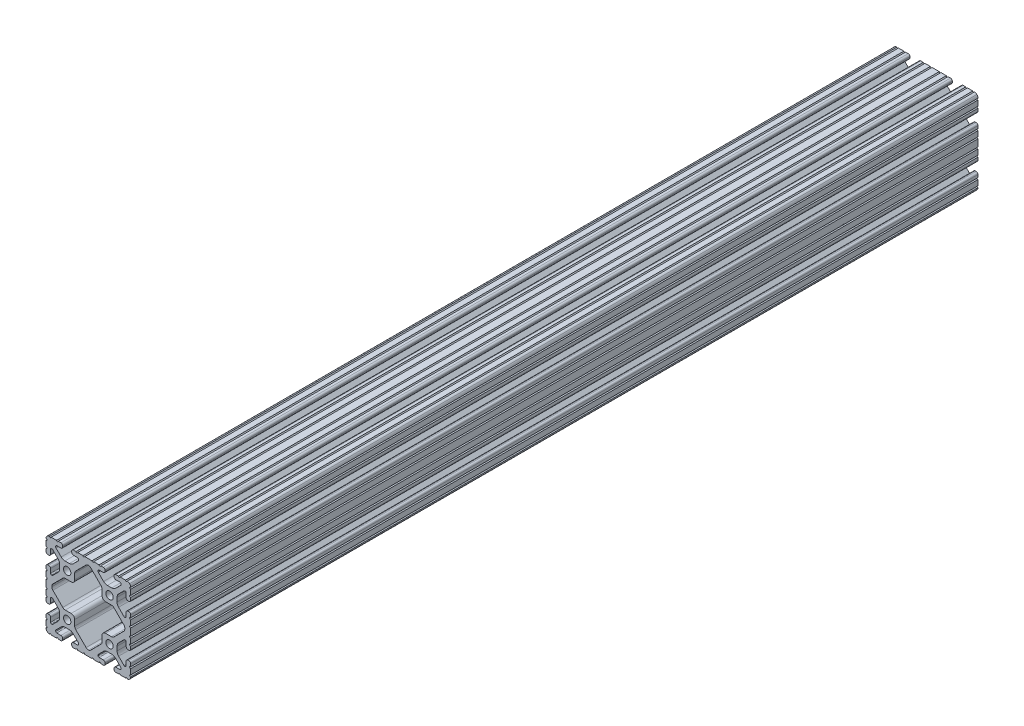
from build123d import *

# Parameters (mm, degrees)
BOSS_EXTRUDE1_DEPTH      = 381
BOSS_EXTRUDE1_DEPTH_BACK = 381
SKETCH3_R                = 3.3274


with BuildPart() as part:
    # Sketch3 → Boss-Extrude1 (new, two sides: drawn at the far end of the back side and taken through both)
    with BuildSketch(Plane.XY.offset(-BOSS_EXTRUDE1_DEPTH_BACK)):
        with BuildLine():
            Line((34.036, 28.448), (34.036, 24.630196049))
            ThreePointArc((34.036, 24.630196049), (34.497248241, 23.51664429), (35.6108, 23.055396049))
            Line((35.6108, 23.055396049), (36.525200183, 23.055396049))
            ThreePointArc((36.525200183, 23.055396049), (37.638751813, 23.516644236), (38.1, 24.630195866))
            Line((38.1, 24.630195866), (38.1, 27.023826138))
            ThreePointArc((38.1, 27.023826138), (37.117780706, 27.7845421), (38.1, 28.545258062))
            Line((38.1, 28.545258062), (38.1, 33.373016026))
            ThreePointArc((38.1, 33.373016026), (37.141472621, 34.109236774), (38.1, 34.845457521))
            ThreePointArc((38.1, 34.845457521), (37.837757813, 36.120195002), (37.086123144, 37.182631793))
            ThreePointArc((37.086123144, 37.182631793), (36.106286572, 37.843374398), (34.952681874, 38.1))
            ThreePointArc((34.952681874, 38.1), (34.190730434, 37.320215335), (33.428778994, 38.1))
            Line((33.428778994, 38.1), (28.601105935, 38.1))
            ThreePointArc((28.601105935, 38.1), (27.839158581, 37.32021942), (27.077211227, 38.1))
            Line((27.077211227, 38.1), (24.6888, 38.1))
            ThreePointArc((24.6888, 38.1), (23.575248241, 37.638751759), (23.114, 36.5252))
            Line((23.114, 36.5252), (23.114, 35.6108))
            ThreePointArc((23.114, 35.6108), (23.575248241, 34.497248241), (24.6888, 34.036))
            Line((24.6888, 34.036), (28.448, 34.036))
            ThreePointArc((28.448, 34.036), (29.076617928, 33.775617928), (29.337, 33.147))
            Line((29.337, 33.147), (29.337, 32.720693454))
            ThreePointArc((29.337, 32.720693454), (29.326675076, 32.273872751), (29.100231244, 31.888543625))
            Line((29.100231244, 31.888543625), (24.409287499, 27.197588341))
            ThreePointArc((24.409287499, 27.197588341), (22.868340045, 26.167958114), (21.050667579, 25.8064))
            Line((21.050667579, 25.8064), (17.049332421, 25.8064))
            ThreePointArc((17.049332421, 25.8064), (15.231659955, 26.167958114), (13.690712501, 27.197588341))
            Line((13.690712501, 27.197588341), (9.023381298, 31.864931024))
            ThreePointArc((9.023381298, 31.864931024), (8.830670886, 32.153343113), (8.763, 32.493548179))
            Line((8.763, 32.493548179), (8.763, 33.147))
            ThreePointArc((8.763, 33.147), (9.023382072, 33.775617928), (9.652, 34.036))
            Line((9.652, 34.036), (13.4112, 34.036))
            ThreePointArc((13.4112, 34.036), (14.524751759, 34.497248241), (14.986, 35.6108))
            Line((14.986, 35.6108), (14.986, 36.5252))
            ThreePointArc((14.986, 36.5252), (14.524751759, 37.638751759), (13.4112, 38.1))
            Line((13.4112, 38.1), (11.128867074, 38.1))
            ThreePointArc((11.128867074, 38.1), (10.367071033, 37.320370693), (9.605274992, 38.1))
            Line((9.605274992, 38.1), (4.777313069, 38.1))
            ThreePointArc((4.777313069, 38.1), (4.015517029, 37.320370693), (3.253720988, 38.1))
            Line((3.253720988, 38.1), (-3.253720988, 38.1))
            ThreePointArc((-3.253720988, 38.1), (-4.015517029, 37.320370693), (-4.777313069, 38.1))
            Line((-4.777313069, 38.1), (-9.605274992, 38.1))
            ThreePointArc((-9.605274992, 38.1), (-10.367071033, 37.320370693), (-11.128867074, 38.1))
            Line((-11.128867074, 38.1), (-13.4112, 38.1))
            ThreePointArc((-13.4112, 38.1), (-14.524751759, 37.638751759), (-14.986, 36.5252))
            Line((-14.986, 36.5252), (-14.986, 35.6108))
            ThreePointArc((-14.986, 35.6108), (-14.524751759, 34.497248241), (-13.4112, 34.036))
            Line((-13.4112, 34.036), (-9.652, 34.036))
            ThreePointArc((-9.652, 34.036), (-9.023382072, 33.775617928), (-8.763, 33.147))
            Line((-8.763, 33.147), (-8.763, 32.493548179))
            ThreePointArc((-8.763, 32.493548179), (-8.830670886, 32.153343113), (-9.023381298, 31.864931024))
            Line((-9.023381298, 31.864931024), (-13.690712501, 27.197588341))
            ThreePointArc((-13.690712501, 27.197588341), (-15.231659955, 26.167958114), (-17.049332421, 25.8064))
            Line((-17.049332421, 25.8064), (-21.050667579, 25.8064))
            ThreePointArc((-21.050667579, 25.8064), (-22.868340045, 26.167958114), (-24.409287499, 27.197588341))
            Line((-24.409287499, 27.197588341), (-29.100231244, 31.888543625))
            ThreePointArc((-29.100231244, 31.888543625), (-29.326675076, 32.273872751), (-29.337, 32.720693454))
            Line((-29.337, 32.720693454), (-29.337, 33.147))
            ThreePointArc((-29.337, 33.147), (-29.076617928, 33.775617928), (-28.448, 34.036))
            Line((-28.448, 34.036), (-24.6888, 34.036))
            ThreePointArc((-24.6888, 34.036), (-23.575248241, 34.497248241), (-23.114, 35.6108))
            Line((-23.114, 35.6108), (-23.114, 36.5252))
            ThreePointArc((-23.114, 36.5252), (-23.575248241, 37.638751759), (-24.6888, 38.1))
            Line((-24.6888, 38.1), (-27.077211227, 38.1))
            ThreePointArc((-27.077211227, 38.1), (-27.839158581, 37.32021942), (-28.601105935, 38.1))
            Line((-28.601105935, 38.1), (-33.428778994, 38.1))
            ThreePointArc((-33.428778994, 38.1), (-34.190730434, 37.320215335), (-34.952681874, 38.1))
            ThreePointArc((-34.952681874, 38.1), (-36.106286572, 37.843374398), (-37.086123144, 37.182631793))
            ThreePointArc((-37.086123144, 37.182631793), (-37.837757813, 36.120195002), (-38.1, 34.845457521))
            ThreePointArc((-38.1, 34.845457521), (-37.141472621, 34.109236774), (-38.1, 33.373016026))
            Line((-38.1, 33.373016026), (-38.1, 28.545258062))
            ThreePointArc((-38.1, 28.545258062), (-37.117780706, 27.7845421), (-38.1, 27.023826138))
            Line((-38.1, 27.023826138), (-38.1, 24.630195866))
            ThreePointArc((-38.1, 24.630195866), (-37.638751813, 23.516644236), (-36.525200183, 23.055396049))
            Line((-36.525200183, 23.055396049), (-35.6108, 23.055396049))
            ThreePointArc((-35.6108, 23.055396049), (-34.497248241, 23.51664429), (-34.036, 24.630196049))
            Line((-34.036, 24.630196049), (-34.036, 28.448))
            ThreePointArc((-34.036, 28.448), (-33.775617928, 29.076617928), (-33.147, 29.337))
            Line((-33.147, 29.337), (-32.664287242, 29.337))
            ThreePointArc((-32.664287242, 29.337), (-32.324081166, 29.269328695), (-32.03566854, 29.076617155))
            Line((-32.03566854, 29.076617155), (-27.19758008, 24.238516795))
            ThreePointArc((-27.19758008, 24.238516795), (-26.167955879, 22.697572205), (-25.8064, 20.879905136))
            Line((-25.8064, 20.879905136), (-25.8064, 17.220094864))
            ThreePointArc((-25.8064, 17.220094864), (-26.167955879, 15.402427795), (-27.19758008, 13.861483205))
            Line((-27.19758008, 13.861483205), (-31.948944541, 9.110107057))
            ThreePointArc((-31.948944541, 9.110107057), (-32.333417096, 8.853210196), (-32.786933649, 8.763))
            Line((-32.786933649, 8.763), (-33.060275787, 8.763))
            ThreePointArc((-33.060275787, 8.763), (-33.750216995, 9.048783005), (-34.036, 9.738724213))
            Line((-34.036, 9.738724213), (-34.036, 13.469803585))
            ThreePointArc((-34.036, 13.469803585), (-34.497248348, 14.583355603), (-35.610800366, 15.044603951))
            Line((-35.610800366, 15.044603951), (-36.5252, 15.044603951))
            ThreePointArc((-36.5252, 15.044603951), (-37.638751759, 14.58335571), (-38.1, 13.469803951))
            Line((-38.1, 13.469803951), (-38.1, 11.075039289))
            ThreePointArc((-38.1, 11.075039289), (-37.117000248, 10.313517272), (-38.1, 9.551995255))
            Line((-38.1, 9.551995255), (-38.1, 4.723759308))
            ThreePointArc((-38.1, 4.723759308), (-37.117000248, 3.962237292), (-38.1, 3.200715275))
            Line((-38.1, 3.200715275), (-38.1, -3.200715275))
            ThreePointArc((-38.1, -3.200715275), (-37.117000248, -3.962237292), (-38.1, -4.723759308))
            Line((-38.1, -4.723759308), (-38.1, -9.551995255))
            ThreePointArc((-38.1, -9.551995255), (-37.117000248, -10.313517272), (-38.1, -11.075039289))
            Line((-38.1, -11.075039289), (-38.1, -13.469803951))
            ThreePointArc((-38.1, -13.469803951), (-37.638751759, -14.58335571), (-36.5252, -15.044603951))
            Line((-36.5252, -15.044603951), (-35.610800366, -15.044603951))
            ThreePointArc((-35.610800366, -15.044603951), (-34.497248348, -14.583355603), (-34.036, -13.469803585))
            Line((-34.036, -13.469803585), (-34.036, -9.738724213))
            ThreePointArc((-34.036, -9.738724213), (-33.750216995, -9.048783005), (-33.060275787, -8.763))
            Line((-33.060275787, -8.763), (-32.786933649, -8.763))
            ThreePointArc((-32.786933649, -8.763), (-32.333417096, -8.853210196), (-31.948944541, -9.110107057))
            Line((-31.948944541, -9.110107057), (-27.19758008, -13.861483205))
            ThreePointArc((-27.19758008, -13.861483205), (-26.167955879, -15.402427795), (-25.8064, -17.220094864))
            Line((-25.8064, -17.220094864), (-25.8064, -20.879905136))
            ThreePointArc((-25.8064, -20.879905136), (-26.167955879, -22.697572205), (-27.19758008, -24.238516795))
            Line((-27.19758008, -24.238516795), (-32.03566854, -29.076617155))
            ThreePointArc((-32.03566854, -29.076617155), (-32.324081166, -29.269328695), (-32.664287242, -29.337))
            Line((-32.664287242, -29.337), (-33.147, -29.337))
            ThreePointArc((-33.147, -29.337), (-33.775617928, -29.076617928), (-34.036, -28.448))
            Line((-34.036, -28.448), (-34.036, -24.630196049))
            ThreePointArc((-34.036, -24.630196049), (-34.497248241, -23.51664429), (-35.6108, -23.055396049))
            Line((-35.6108, -23.055396049), (-36.525200183, -23.055396049))
            ThreePointArc((-36.525200183, -23.055396049), (-37.638751813, -23.516644236), (-38.1, -24.630195866))
            Line((-38.1, -24.630195866), (-38.1, -27.023826138))
            ThreePointArc((-38.1, -27.023826138), (-37.117780706, -27.7845421), (-38.1, -28.545258062))
            Line((-38.1, -28.545258062), (-38.1, -33.373016026))
            ThreePointArc((-38.1, -33.373016026), (-37.141472621, -34.109236774), (-38.1, -34.845457521))
            ThreePointArc((-38.1, -34.845457521), (-37.837757813, -36.120195002), (-37.086123144, -37.182631793))
            ThreePointArc((-37.086123144, -37.182631793), (-36.106286572, -37.843374398), (-34.952681874, -38.1))
            ThreePointArc((-34.952681874, -38.1), (-34.190730434, -37.320215335), (-33.428778994, -38.1))
            Line((-33.428778994, -38.1), (-28.601105935, -38.1))
            ThreePointArc((-28.601105935, -38.1), (-27.839158581, -37.32021942), (-27.077211227, -38.1))
            Line((-27.077211227, -38.1), (-24.6888, -38.1))
            ThreePointArc((-24.6888, -38.1), (-23.575248241, -37.638751759), (-23.114, -36.5252))
            Line((-23.114, -36.5252), (-23.114, -35.6108))
            ThreePointArc((-23.114, -35.6108), (-23.575248241, -34.497248241), (-24.6888, -34.036))
            Line((-24.6888, -34.036), (-28.448, -34.036))
            ThreePointArc((-28.448, -34.036), (-29.076617928, -33.775617928), (-29.337, -33.147))
            Line((-29.337, -33.147), (-29.337, -32.720693454))
            ThreePointArc((-29.337, -32.720693454), (-29.326675076, -32.273872751), (-29.100231244, -31.888543625))
            Line((-29.100231244, -31.888543625), (-24.409287499, -27.197588341))
            ThreePointArc((-24.409287499, -27.197588341), (-22.868340045, -26.167958114), (-21.050667579, -25.8064))
            Line((-21.050667579, -25.8064), (-17.049332421, -25.8064))
            ThreePointArc((-17.049332421, -25.8064), (-15.231659955, -26.167958114), (-13.690712501, -27.197588341))
            Line((-13.690712501, -27.197588341), (-9.023381298, -31.864931024))
            ThreePointArc((-9.023381298, -31.864931024), (-8.830670886, -32.153343113), (-8.763, -32.493548179))
            Line((-8.763, -32.493548179), (-8.763, -33.147))
            ThreePointArc((-8.763, -33.147), (-9.023382072, -33.775617928), (-9.652, -34.036))
            Line((-9.652, -34.036), (-13.4112, -34.036))
            ThreePointArc((-13.4112, -34.036), (-14.524751759, -34.497248241), (-14.986, -35.6108))
            Line((-14.986, -35.6108), (-14.986, -36.5252))
            ThreePointArc((-14.986, -36.5252), (-14.524751759, -37.638751759), (-13.4112, -38.1))
            Line((-13.4112, -38.1), (-11.128867074, -38.1))
            ThreePointArc((-11.128867074, -38.1), (-10.367071033, -37.320370693), (-9.605274992, -38.1))
            Line((-9.605274992, -38.1), (-4.777313069, -38.1))
            ThreePointArc((-4.777313069, -38.1), (-4.015517029, -37.320370693), (-3.253720988, -38.1))
            Line((-3.253720988, -38.1), (3.253720988, -38.1))
            ThreePointArc((3.253720988, -38.1), (4.015517029, -37.320370693), (4.777313069, -38.1))
            Line((4.777313069, -38.1), (9.605274992, -38.1))
            ThreePointArc((9.605274992, -38.1), (10.367071033, -37.320370693), (11.128867074, -38.1))
            Line((11.128867074, -38.1), (13.4112, -38.1))
            ThreePointArc((13.4112, -38.1), (14.524751759, -37.638751759), (14.986, -36.5252))
            Line((14.986, -36.5252), (14.986, -35.6108))
            ThreePointArc((14.986, -35.6108), (14.524751759, -34.497248241), (13.4112, -34.036))
            Line((13.4112, -34.036), (9.652, -34.036))
            ThreePointArc((9.652, -34.036), (9.023382072, -33.775617928), (8.763, -33.147))
            Line((8.763, -33.147), (8.763, -32.493548179))
            ThreePointArc((8.763, -32.493548179), (8.830670886, -32.153343113), (9.023381298, -31.864931024))
            Line((9.023381298, -31.864931024), (13.690712501, -27.197588341))
            ThreePointArc((13.690712501, -27.197588341), (15.231659955, -26.167958114), (17.049332421, -25.8064))
            Line((17.049332421, -25.8064), (21.050667579, -25.8064))
            ThreePointArc((21.050667579, -25.8064), (22.868340045, -26.167958114), (24.409287499, -27.197588341))
            Line((24.409287499, -27.197588341), (29.100231244, -31.888543625))
            ThreePointArc((29.100231244, -31.888543625), (29.326675076, -32.273872751), (29.337, -32.720693454))
            Line((29.337, -32.720693454), (29.337, -33.147))
            ThreePointArc((29.337, -33.147), (29.076617928, -33.775617928), (28.448, -34.036))
            Line((28.448, -34.036), (24.6888, -34.036))
            ThreePointArc((24.6888, -34.036), (23.575248241, -34.497248241), (23.114, -35.6108))
            Line((23.114, -35.6108), (23.114, -36.5252))
            ThreePointArc((23.114, -36.5252), (23.575248241, -37.638751759), (24.6888, -38.1))
            Line((24.6888, -38.1), (27.077211227, -38.1))
            ThreePointArc((27.077211227, -38.1), (27.839158581, -37.32021942), (28.601105935, -38.1))
            Line((28.601105935, -38.1), (33.428778994, -38.1))
            ThreePointArc((33.428778994, -38.1), (34.190730434, -37.320215335), (34.952681874, -38.1))
            ThreePointArc((34.952681874, -38.1), (36.106286572, -37.843374398), (37.086123144, -37.182631793))
            ThreePointArc((37.086123144, -37.182631793), (37.837757813, -36.120195002), (38.1, -34.845457521))
            ThreePointArc((38.1, -34.845457521), (37.141472621, -34.109236774), (38.1, -33.373016026))
            Line((38.1, -33.373016026), (38.1, -28.545258062))
            ThreePointArc((38.1, -28.545258062), (37.117780706, -27.7845421), (38.1, -27.023826138))
            Line((38.1, -27.023826138), (38.1, -24.630195866))
            ThreePointArc((38.1, -24.630195866), (37.638751813, -23.516644236), (36.525200183, -23.055396049))
            Line((36.525200183, -23.055396049), (35.6108, -23.055396049))
            ThreePointArc((35.6108, -23.055396049), (34.497248241, -23.51664429), (34.036, -24.630196049))
            Line((34.036, -24.630196049), (34.036, -28.448))
            ThreePointArc((34.036, -28.448), (33.775617928, -29.076617928), (33.147, -29.337))
            Line((33.147, -29.337), (32.664287242, -29.337))
            ThreePointArc((32.664287242, -29.337), (32.324081166, -29.269328695), (32.03566854, -29.076617155))
            Line((32.03566854, -29.076617155), (27.19758008, -24.238516795))
            ThreePointArc((27.19758008, -24.238516795), (26.167955879, -22.697572205), (25.8064, -20.879905136))
            Line((25.8064, -20.879905136), (25.8064, -17.220094864))
            ThreePointArc((25.8064, -17.220094864), (26.167955879, -15.402427795), (27.19758008, -13.861483205))
            Line((27.19758008, -13.861483205), (31.948944541, -9.110107057))
            ThreePointArc((31.948944541, -9.110107057), (32.333417096, -8.853210196), (32.786933649, -8.763))
            Line((32.786933649, -8.763), (33.060275787, -8.763))
            ThreePointArc((33.060275787, -8.763), (33.750216995, -9.048783005), (34.036, -9.738724213))
            Line((34.036, -9.738724213), (34.036, -13.469803585))
            ThreePointArc((34.036, -13.469803585), (34.497248348, -14.583355603), (35.610800366, -15.044603951))
            Line((35.610800366, -15.044603951), (36.5252, -15.044603951))
            ThreePointArc((36.5252, -15.044603951), (37.638751759, -14.58335571), (38.1, -13.469803951))
            Line((38.1, -13.469803951), (38.1, -11.075039289))
            ThreePointArc((38.1, -11.075039289), (37.117000248, -10.313517272), (38.1, -9.551995255))
            Line((38.1, -9.551995255), (38.1, -4.723759308))
            ThreePointArc((38.1, -4.723759308), (37.117000248, -3.962237292), (38.1, -3.200715275))
            Line((38.1, -3.200715275), (38.1, 3.200715275))
            ThreePointArc((38.1, 3.200715275), (37.117000248, 3.962237292), (38.1, 4.723759308))
            Line((38.1, 4.723759308), (38.1, 9.551995255))
            ThreePointArc((38.1, 9.551995255), (37.117000248, 10.313517272), (38.1, 11.075039289))
            Line((38.1, 11.075039289), (38.1, 13.469803951))
            ThreePointArc((38.1, 13.469803951), (37.638751759, 14.58335571), (36.5252, 15.044603951))
            Line((36.5252, 15.044603951), (35.610800366, 15.044603951))
            ThreePointArc((35.610800366, 15.044603951), (34.497248348, 14.583355603), (34.036, 13.469803585))
            Line((34.036, 13.469803585), (34.036, 9.738724213))
            ThreePointArc((34.036, 9.738724213), (33.750216995, 9.048783005), (33.060275787, 8.763))
            Line((33.060275787, 8.763), (32.786933649, 8.763))
            ThreePointArc((32.786933649, 8.763), (32.333417096, 8.853210196), (31.948944541, 9.110107057))
            Line((31.948944541, 9.110107057), (27.19758008, 13.861483205))
            ThreePointArc((27.19758008, 13.861483205), (26.167955879, 15.402427795), (25.8064, 17.220094864))
            Line((25.8064, 17.220094864), (25.8064, 20.879905136))
            ThreePointArc((25.8064, 20.879905136), (26.167955879, 22.697572205), (27.19758008, 24.238516795))
            Line((27.19758008, 24.238516795), (32.03566854, 29.076617155))
            ThreePointArc((32.03566854, 29.076617155), (32.324081166, 29.269328695), (32.664287242, 29.337))
            Line((32.664287242, 29.337), (33.147, 29.337))
            ThreePointArc((33.147, 29.337), (33.775617928, 29.076617928), (34.036, 28.448))
        make_face()
        with Locations((19.05, 19.05)):
            Circle(SKETCH3_R, mode=Mode.SUBTRACT)
        with Locations((-19.05, 19.05)):
            Circle(SKETCH3_R, mode=Mode.SUBTRACT)
        with Locations((19.05, -19.05)):
            Circle(SKETCH3_R, mode=Mode.SUBTRACT)
        with Locations((-19.05, -19.05)):
            Circle(SKETCH3_R, mode=Mode.SUBTRACT)
        with BuildLine():
            Line((-11.363666791, -22.843321003), (-2.051515952, -32.155494748))
            ThreePointArc((-2.051515952, -32.155494748), (-1.11031328, -32.786013752), (0, -33.011005091))
            ThreePointArc((0, -33.011005091), (1.11031328, -32.786013752), (2.051515952, -32.155494748))
            Line((2.051515952, -32.155494748), (11.363666791, -22.843321003))
            ThreePointArc((11.363666791, -22.843321003), (12.051918263, -21.813277828), (12.2936, -20.598259734))
            Line((12.2936, -20.598259734), (12.2936, -15.4686))
            ThreePointArc((12.2936, -15.4686), (13.22353597, -13.22353597), (15.4686, -12.2936))
            Line((15.4686, -12.2936), (20.769026744, -12.2936))
            ThreePointArc((20.769026744, -12.2936), (21.984048446, -12.051916769), (23.014093535, -11.363661269))
            Line((23.014093535, -11.363661269), (31.902125566, -2.475607377))
            ThreePointArc((31.902125566, -2.475607377), (32.607298578, -1.335259481), (32.728725173, 0))
            ThreePointArc((32.728725173, 0), (32.607298578, 1.335259481), (31.902125566, 2.475607377))
            Line((31.902125566, 2.475607377), (23.014093535, 11.363661269))
            ThreePointArc((23.014093535, 11.363661269), (21.984048446, 12.051916769), (20.769026744, 12.2936))
            Line((20.769026744, 12.2936), (15.4686, 12.2936))
            ThreePointArc((15.4686, 12.2936), (13.22353597, 13.22353597), (12.2936, 15.4686))
            Line((12.2936, 15.4686), (12.2936, 20.598259734))
            ThreePointArc((12.2936, 20.598259734), (12.051918263, 21.813277828), (11.363666791, 22.843321003))
            Line((11.363666791, 22.843321003), (2.051515952, 32.155494748))
            ThreePointArc((2.051515952, 32.155494748), (1.11031328, 32.786013752), (0, 33.011005091))
            ThreePointArc((0, 33.011005091), (-1.11031328, 32.786013752), (-2.051515952, 32.155494748))
            Line((-2.051515952, 32.155494748), (-11.363666791, 22.843321003))
            ThreePointArc((-11.363666791, 22.843321003), (-12.051918263, 21.813277828), (-12.2936, 20.598259734))
            Line((-12.2936, 20.598259734), (-12.2936, 15.4686))
            ThreePointArc((-12.2936, 15.4686), (-13.22353597, 13.22353597), (-15.4686, 12.2936))
            Line((-15.4686, 12.2936), (-20.769026744, 12.2936))
            ThreePointArc((-20.769026744, 12.2936), (-21.984048446, 12.051916769), (-23.014093535, 11.363661269))
            Line((-23.014093535, 11.363661269), (-31.902125566, 2.475607377))
            ThreePointArc((-31.902125566, 2.475607377), (-32.607298578, 1.335259481), (-32.728725173, 0))
            ThreePointArc((-32.728725173, 0), (-32.607298578, -1.335259481), (-31.902125566, -2.475607377))
            Line((-31.902125566, -2.475607377), (-23.014093535, -11.363661269))
            ThreePointArc((-23.014093535, -11.363661269), (-21.984048446, -12.051916769), (-20.769026744, -12.2936))
            Line((-20.769026744, -12.2936), (-15.4686, -12.2936))
            ThreePointArc((-15.4686, -12.2936), (-13.22353597, -13.22353597), (-12.2936, -15.4686))
            Line((-12.2936, -15.4686), (-12.2936, -20.598259734))
            ThreePointArc((-12.2936, -20.598259734), (-12.051918263, -21.813277828), (-11.363666791, -22.843321003))
        make_face(mode=Mode.SUBTRACT)
    extrude(amount=BOSS_EXTRUDE1_DEPTH + BOSS_EXTRUDE1_DEPTH_BACK)


solid = part.part
